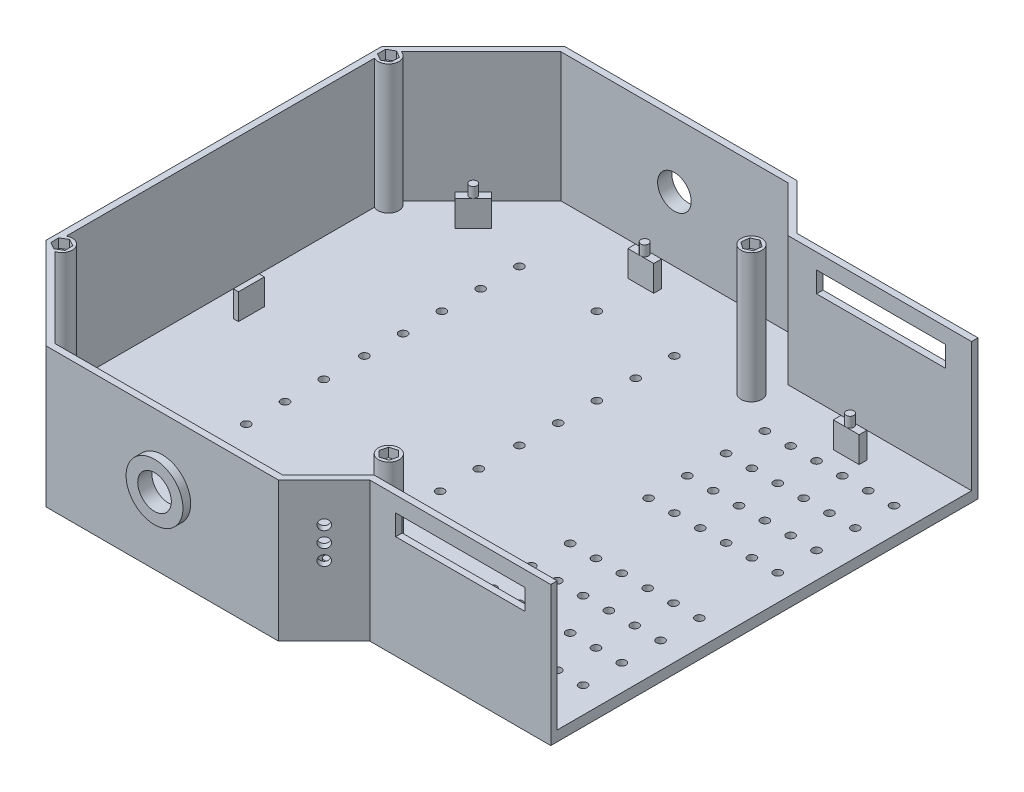
from build123d import *

# Parameters (mm, degrees)
Y_KSEKLIK_EKSTR_ZYON1_DEPTH = 4
Y_KSEKLIK_EKSTR_ZYON2_DEPTH = 50
IZIM7_W                     = 10
IZIM7_H                     = 3
IZIM7_W_2                   = 2
IZIM7_H_2                   = 10
Y_KSEKLIK_EKSTR_ZYON3_DEPTH = 10
IZIM8_R                     = 11
Y_KSEKLIK_EKSTR_ZYON5_DEPTH = 3
Y_KSEKLIK_EKSTR_ZYON6_START = 3
IZIM9_R                     = 11
Y_KSEKLIK_EKSTR_ZYON6_DEPTH = 3
IZIM11_R                    = 6.5
KES_EKSTR_ZYON4_DEPTH       = 232
IZIM12_R                    = 1.6
KES_EKSTR_ZYON5_DEPTH       = 10
IZIM13_R                    = 1.6
KES_EKSTR_ZYON6_DEPTH       = 10
IZIM15_W                    = 50
IZIM15_H                    = 8
KES_EKSTR_ZYON8_DEPTH       = 190
IZIM16_R                    = 4
Y_KSEKLIK_EKSTR_ZYON7_DEPTH = 50
IZIM17_R                    = 1.6
KES_EKSTR_ZYON9_DEPTH       = 190
KES_EKSTR_ZYON10_DEPTH      = 3.5
IZIM19_R                    = 1.5
Y_KSEKLIK_EKSTR_ZYON8_DEPTH = 14
IZIM20_R                    = 2
KES_EKSTR_ZYON11_DEPTH      = 14
IZIM21_R                    = 2
KES_EKSTR_ZYON12_DEPTH      = 14


with BuildPart() as part:
    # Çizim1 → Yükseklik-Ekstrüzyon1 (new body)
    with BuildSketch(Plane(origin=(0, 0, 0), x_dir=(1, 0, 0), z_dir=(0, 1, 0))):
        Polygon((-93.907506655, 105.577086382), (-129.262845715, 70.221747322), (-129.262845715, -59.778252678), (-93.907506655, -95.133591737), (-3.907506655, -95.133591737), (13.770162874, -77.455922207), (83.770162874, -77.455922207), (83.770162874, 87.899416852), (13.770162874, 87.899416852), (-3.907506655, 105.577086382), align=None)
    extrude(amount=Y_KSEKLIK_EKSTR_ZYON1_DEPTH)

    # Çizim2 → Yükseklik-Ekstrüzyon2 (add)
    with BuildSketch(Plane(origin=(0, 4, 0), x_dir=(1, 0, 0), z_dir=(0, 1, 0))):
        Polygon((83.770162874, 87.899416852), (13.770162874, 87.899416852), (-3.907506655, 105.577086382), (-93.907506655, 105.577086382), (-129.262845715, 70.221747322), (-129.262845715, -59.778252678), (-93.907506655, -95.133591737), (-3.907506655, -95.133591737), (13.770162874, -77.455922207), (83.770162874, -77.455922207), (83.770162874, -74.955922207), (12.734628968, -74.955922207), (-4.943040561, -92.633591737), (-92.871972749, -92.633591737), (-126.762845715, -58.742718772), (-126.762845715, 69.186213416), (-92.871972749, 103.077086382), (-4.943040561, 103.077086382), (12.734628968, 85.399416852), (83.770162874, 85.399416852), align=None)
    extrude(amount=Y_KSEKLIK_EKSTR_ZYON2_DEPTH)

    # Çizim7 → Yükseklik-Ekstrüzyon3 (add)
    with BuildSketch(Plane(origin=(0, 4, 0), x_dir=(1, 0, 0), z_dir=(0, 1, 0))):
        with Locations((48.252395921, 73.899416852)):
            Rectangle(IZIM7_W, IZIM7_H)
        Polygon((-6.710807514, 90.702717711), (0.360260298, 83.631649899), (-1.761060046, 81.510329555), (-8.832127858, 88.581397367), align=None)
        with Locations((-48.907506655, 91.577086382)):
            Rectangle(IZIM7_W, IZIM7_H)
        Polygon((-106.281875326, 75.525048181), (-99.210807514, 82.596115993), (-97.089487171, 80.474795649), (-104.160554983, 73.403727838), align=None)
        with Locations((-115.762845715, 5.221747322)):
            Rectangle(IZIM7_W_2, IZIM7_H_2)
        with Locations((48.252395921, -63.455922207)):
            Rectangle(IZIM7_W, IZIM7_H)
        Polygon((0.360260298, -73.188155254), (-1.761060046, -71.066834911), (-8.832127858, -78.137902723), (-6.710807514, -80.259223066), align=None)
        with Locations((-48.907506655, -81.133591737)):
            Rectangle(IZIM7_W, IZIM7_H)
        Polygon((-104.160554983, -62.960233193), (-106.281875326, -65.081553537), (-99.210807514, -72.152621349), (-97.089487171, -70.031301005), align=None)
    extrude(amount=Y_KSEKLIK_EKSTR_ZYON3_DEPTH)

    # Çizim8 → Yükseklik-Ekstrüzyon5 (add)
    with BuildSketch(Plane.XY.offset(95.133591737)):
        with Locations((-48.907506655, 29)):
            Circle(IZIM8_R)
    extrude(amount=Y_KSEKLIK_EKSTR_ZYON5_DEPTH)

    # Çizim9 → Yükseklik-Ekstrüzyon6 (add)
    with BuildSketch(Plane(origin=(0, 0, -105.577086382), x_dir=(-1, 0, 0), z_dir=(0, 0, -1)).offset(Y_KSEKLIK_EKSTR_ZYON6_START)):
        with Locations(Location((48.907506655, 29, 0), (0, 0, 180))):
            Circle(IZIM9_R)
    extrude(amount=-Y_KSEKLIK_EKSTR_ZYON6_DEPTH)

    # Çizim11 → Kes-Ekstrüzyon4 (cut)
    with BuildSketch(Plane(origin=(0, 0, -108.577086382), x_dir=(-1, 0, 0), z_dir=(0, 0, -1))):
        with Locations((48.907506655, 29)):
            Circle(IZIM11_R)
    extrude(amount=-KES_EKSTR_ZYON4_DEPTH, mode=Mode.SUBTRACT)

    # Çizim12 → Kes-Ekstrüzyon5 (cut)
    with BuildSketch(Plane(origin=(0, 4, 0), x_dir=(1, 0, 0), z_dir=(0, 1, 0))):
        with Locations(Location((-78.907506655, 73.077086382, 0), (0, 0, 270))):
            Circle(IZIM12_R)
        with Locations(Location((-18.907506655, 73.077086382, 0), (0, 0, 270))):
            Circle(IZIM12_R)
        with Locations(Location((-18.907506655, 58.077086382, 0), (0, 0, 270))):
            Circle(IZIM12_R)
        with Locations(Location((-18.907506655, 43.077086382, 0), (0, 0, 270))):
            Circle(IZIM12_R)
        with Locations(Location((-18.907506655, 28.077086382, 0), (0, 0, 270))):
            Circle(IZIM12_R)
        with Locations(Location((-18.907506655, 13.077086382, 0), (0, 0, 270))):
            Circle(IZIM12_R)
        with Locations(Location((-18.907506655, -2.633591737, 0), (0, 0, 270))):
            Circle(IZIM12_R)
        with Locations(Location((-18.907506655, -17.633591737, 0), (0, 0, 270))):
            Circle(IZIM12_R)
        with Locations(Location((-18.907506655, -32.633591737, 0), (0, 0, 270))):
            Circle(IZIM12_R)
        with Locations(Location((-18.907506655, -47.633591737, 0), (0, 0, 270))):
            Circle(IZIM12_R)
        with Locations(Location((-78.907506655, -47.633591737, 0), (0, 0, 270))):
            Circle(IZIM12_R)
        with Locations(Location((-78.907506655, -62.633591737, 0), (0, 0, 270))):
            Circle(IZIM12_R)
        with Locations(Location((-18.907506655, -62.633591737, 0), (0, 0, 270))):
            Circle(IZIM12_R)
        with Locations(Location((-78.907506655, 58.077086382, 0), (0, 0, 270))):
            Circle(IZIM12_R)
        with Locations(Location((-78.907506655, 43.077086382, 0), (0, 0, 270))):
            Circle(IZIM12_R)
        with Locations(Location((-78.907506655, 28.077086382, 0), (0, 0, 270))):
            Circle(IZIM12_R)
        with Locations(Location((-78.907506655, 13.077086382, 0), (0, 0, 270))):
            Circle(IZIM12_R)
        with Locations(Location((-78.907506655, -2.633591737, 0), (0, 0, 270))):
            Circle(IZIM12_R)
        with Locations(Location((-78.907506655, -17.633591737, 0), (0, 0, 270))):
            Circle(IZIM12_R)
        with Locations(Location((-78.907506655, -32.633591737, 0), (0, 0, 270))):
            Circle(IZIM12_R)
        with Locations(Location((-48.907506655, -62.633591737, 0), (0, 0, 270))):
            Circle(IZIM12_R)
        with Locations(Location((-48.907506655, 73.077086382, 0), (0, 0, 270))):
            Circle(IZIM12_R)
    extrude(amount=-KES_EKSTR_ZYON5_DEPTH, mode=Mode.SUBTRACT)

    # Çizim13 → Kes-Ekstrüzyon6 (cut)
    with BuildSketch(Plane(origin=(0, 4, 0), x_dir=(1, 0, 0), z_dir=(0, 1, 0))):
        with Locations(Location((73.770162874, 65.399416852, 0), (0, 0, 270))):
            Circle(IZIM13_R)
        with Locations(Location((63.770162874, 65.399416852, 0), (0, 0, 270))):
            Circle(IZIM13_R)
        with Locations(Location((53.770162874, 65.399416852, 0), (0, 0, 270))):
            Circle(IZIM13_R)
        with Locations(Location((43.770162874, 65.399416852, 0), (0, 0, 270))):
            Circle(IZIM13_R)
        with Locations(Location((33.770162874, 65.399416852, 0), (0, 0, 270))):
            Circle(IZIM13_R)
        with Locations(Location((23.770162874, 65.399416852, 0), (0, 0, 270))):
            Circle(IZIM13_R)
        with Locations(Location((23.770162874, 50.399416852, 0), (0, 0, 270))):
            Circle(IZIM13_R)
        with Locations(Location((33.770162874, 50.399416852, 0), (0, 0, 270))):
            Circle(IZIM13_R)
        with Locations(Location((43.770162874, 50.399416852, 0), (0, 0, 270))):
            Circle(IZIM13_R)
        with Locations(Location((53.770162874, 50.399416852, 0), (0, 0, 270))):
            Circle(IZIM13_R)
        with Locations(Location((63.770162874, 50.399416852, 0), (0, 0, 270))):
            Circle(IZIM13_R)
        with Locations(Location((73.770162874, 50.399416852, 0), (0, 0, 270))):
            Circle(IZIM13_R)
        with Locations(Location((53.770162874, 35.399416852, 0), (0, 0, 90))):
            Circle(IZIM13_R)
        with Locations(Location((63.770162874, 35.399416852, 0), (0, 0, 90))):
            Circle(IZIM13_R)
        with Locations(Location((73.770162874, 35.399416852, 0), (0, 0, 90))):
            Circle(IZIM13_R)
        with Locations(Location((73.770162874, 20.399416852, 0), (0, 0, 90))):
            Circle(IZIM13_R)
        with Locations(Location((63.770162874, 20.399416852, 0), (0, 0, 90))):
            Circle(IZIM13_R)
        with Locations(Location((53.770162874, 20.399416852, 0), (0, 0, 90))):
            Circle(IZIM13_R)
        with Locations(Location((43.770162874, 20.399416852, 0), (0, 0, 90))):
            Circle(IZIM13_R)
        with Locations(Location((43.770162874, 35.399416852, 0), (0, 0, 90))):
            Circle(IZIM13_R)
        with Locations(Location((33.770162874, 35.399416852, 0), (0, 0, 90))):
            Circle(IZIM13_R)
        with Locations(Location((33.770162874, 20.399416852, 0), (0, 0, 90))):
            Circle(IZIM13_R)
        with Locations(Location((23.770162874, 20.399416852, 0), (0, 0, 90))):
            Circle(IZIM13_R)
        with Locations(Location((23.770162874, 35.399416852, 0), (0, 0, 90))):
            Circle(IZIM13_R)
        with Locations(Location((23.770162874, -24.955922207, 0), (0, 0, 270))):
            Circle(IZIM13_R)
        with Locations(Location((23.770162874, -9.955922207, 0), (0, 0, 270))):
            Circle(IZIM13_R)
        with Locations(Location((33.770162874, -9.955922207, 0), (0, 0, 270))):
            Circle(IZIM13_R)
        with Locations(Location((33.770162874, -24.955922207, 0), (0, 0, 270))):
            Circle(IZIM13_R)
        with Locations(Location((43.770162874, -24.955922207, 0), (0, 0, 270))):
            Circle(IZIM13_R)
        with Locations(Location((43.770162874, -9.955922207, 0), (0, 0, 270))):
            Circle(IZIM13_R)
        with Locations(Location((53.770162874, -9.955922207, 0), (0, 0, 270))):
            Circle(IZIM13_R)
        with Locations(Location((63.770162874, -9.955922207, 0), (0, 0, 270))):
            Circle(IZIM13_R)
        with Locations(Location((73.770162874, -9.955922207, 0), (0, 0, 270))):
            Circle(IZIM13_R)
        with Locations(Location((73.770162874, -24.955922207, 0), (0, 0, 270))):
            Circle(IZIM13_R)
        with Locations(Location((63.770162874, -24.955922207, 0), (0, 0, 270))):
            Circle(IZIM13_R)
        with Locations(Location((53.770162874, -24.955922207, 0), (0, 0, 270))):
            Circle(IZIM13_R)
        with Locations(Location((73.770162874, -39.955922207, 0), (0, 0, 90))):
            Circle(IZIM13_R)
        with Locations(Location((63.770162874, -39.955922207, 0), (0, 0, 90))):
            Circle(IZIM13_R)
        with Locations(Location((53.770162874, -39.955922207, 0), (0, 0, 90))):
            Circle(IZIM13_R)
        with Locations(Location((43.770162874, -39.955922207, 0), (0, 0, 90))):
            Circle(IZIM13_R)
        with Locations(Location((33.770162874, -39.955922207, 0), (0, 0, 90))):
            Circle(IZIM13_R)
        with Locations(Location((23.770162874, -39.955922207, 0), (0, 0, 90))):
            Circle(IZIM13_R)
        with Locations(Location((23.770162874, -54.955922207, 0), (0, 0, 90))):
            Circle(IZIM13_R)
        with Locations(Location((33.770162874, -54.955922207, 0), (0, 0, 90))):
            Circle(IZIM13_R)
        with Locations(Location((43.770162874, -54.955922207, 0), (0, 0, 90))):
            Circle(IZIM13_R)
        with Locations(Location((53.770162874, -54.955922207, 0), (0, 0, 90))):
            Circle(IZIM13_R)
        with Locations(Location((63.770162874, -54.955922207, 0), (0, 0, 90))):
            Circle(IZIM13_R)
        with Locations(Location((73.770162874, -54.955922207, 0), (0, 0, 90))):
            Circle(IZIM13_R)
    extrude(amount=-KES_EKSTR_ZYON6_DEPTH, mode=Mode.SUBTRACT)

    # Çizim15 → Kes-Ekstrüzyon8 (cut)
    with BuildSketch(Plane.XY.offset(77.455922207)):
        with Locations((48.770162874, 44)):
            Rectangle(IZIM15_W, IZIM15_H)
    extrude(amount=-KES_EKSTR_ZYON8_DEPTH, mode=Mode.SUBTRACT)

    # Çizim16 → Yükseklik-Ekstrüzyon7 (add)
    with BuildSketch(Plane(origin=(0, 4, 0), x_dir=(1, 0, 0), z_dir=(0, 1, 0))):
        with Locations(Location((8.592493345, 75.399416852, 0), (0, 0, 90))):
            Circle(IZIM16_R)
        with Locations((-124.91508665, 68.420846552)):
            Circle(IZIM16_R)
        with Locations((-124.91508665, -57.977351907)):
            Circle(IZIM16_R)
        with Locations(Location((8.592493345, -64.955922207, 0), (0, 0, 90))):
            Circle(IZIM16_R)
    extrude(amount=Y_KSEKLIK_EKSTR_ZYON7_DEPTH)

    # Çizim17 → Kes-Ekstrüzyon9 (cut)
    with BuildSketch(Plane(origin=(0, 54, 0), x_dir=(1, 0, 0), z_dir=(0, 1, 0))):
        with Locations(Location((-124.91508665, 68.420846552, 0), (0, 0, 270))):
            Circle(IZIM17_R)
        with Locations(Location((-124.91508665, -57.977351907, 0), (0, 0, 270))):
            Circle(IZIM17_R)
        with Locations(Location((8.592493345, 75.399416852, 0), (0, 0, 270))):
            Circle(IZIM17_R)
        with Locations(Location((8.592493345, -64.955922207, 0), (0, 0, 270))):
            Circle(IZIM17_R)
    extrude(amount=-KES_EKSTR_ZYON9_DEPTH, mode=Mode.SUBTRACT)

    # Çizim18 → Kes-Ekstrüzyon10 (cut)
    with BuildSketch(Plane(origin=(0, 54, 0), x_dir=(1, 0, 0), z_dir=(0, 1, 0))):
        Polygon((-122.239727613, 66.854815255), (-122.221184245, 69.954759794), (-124.896543282, 71.52079109), (-127.590445687, 69.986877848), (-127.608989054, 66.88693331), (-124.933630017, 65.320902013), align=None)
        Polygon((-122.198371365, -59.470488895), (-122.263634445, -56.37117595), (-124.980349729, -54.878038962), (-127.631801934, -56.48421492), (-127.566538854, -59.583527865), (-124.84982357, -61.076664852), align=None)
        Polygon((10.820187794, -67.111699895), (11.573298812, -64.104571066), (9.345604363, -61.948793378), (6.364798895, -62.800144519), (5.611687877, -65.807273349), (7.839382327, -67.963051036), align=None)
        Polygon((11.110359734, 73.591006267), (11.417556047, 76.675747816), (8.899689657, 78.484158401), (6.074626955, 77.207827437), (5.767430643, 74.123085888), (8.285297032, 72.314675303), align=None)
    extrude(amount=-KES_EKSTR_ZYON10_DEPTH, mode=Mode.SUBTRACT)

    # Çizim19 → Yükseklik-Ekstrüzyon8 (add)
    with BuildSketch(Plane(origin=(0, 4, 0), x_dir=(1, 0, 0), z_dir=(0, 1, 0))):
        with Locations(Location((-101.685681248, 77.999921915, 0), (0, 0, 135))):
            Circle(IZIM19_R)
        with Locations(Location((-101.685681248, -67.556427271, 0), (0, 0, 45))):
            Circle(IZIM19_R)
        with Locations(Location((-48.907506655, -81.133591737, 0), (0, 0, 270))):
            Circle(IZIM19_R)
        with Locations(Location((-4.23593378, -75.663028989, 0), (0, 0, 135))):
            Circle(IZIM19_R)
        with Locations(Location((48.252395921, -63.455922207, 0), (0, 0, 270))):
            Circle(IZIM19_R)
        with Locations(Location((-48.907506655, 91.577086382, 0), (0, 0, 270))):
            Circle(IZIM19_R)
        with Locations(Location((-4.23593378, 86.106523633, 0), (0, 0, 45))):
            Circle(IZIM19_R)
        with Locations(Location((48.252395921, 73.899416852, 0), (0, 0, 270))):
            Circle(IZIM19_R)
    extrude(amount=Y_KSEKLIK_EKSTR_ZYON8_DEPTH)

    # Çizim20 → Kes-Ekstrüzyon11 (cut)
    with BuildSketch(Plane(origin=(45.613042541, 0, 45.613042541), x_dir=(0.7071067811865477, 0, -0.7071067811865474), z_dir=(0.7071067811865474, 0, 0.7071067811865477))):
        with Locations((-57.532632289, 39)):
            Circle(IZIM20_R)
        with Locations((-57.532632289, 33)):
            Circle(IZIM20_R)
        with Locations((-57.532632289, 27)):
            Circle(IZIM20_R)
    extrude(amount=-KES_EKSTR_ZYON11_DEPTH, mode=Mode.SUBTRACT)

    # Çizim21 → Kes-Ekstrüzyon12 (cut)
    with BuildSketch(Plane(origin=(50.834789863, 0, -50.834789863), x_dir=(-0.7071067811865474, 0, -0.7071067811865477), z_dir=(0.7071067811865477, 0, -0.7071067811865474))):
        with Locations((64.917298172, 39)):
            Circle(IZIM21_R)
        with Locations((64.917298172, 33)):
            Circle(IZIM21_R)
        with Locations((64.917298172, 27)):
            Circle(IZIM21_R)
    extrude(amount=-KES_EKSTR_ZYON12_DEPTH, mode=Mode.SUBTRACT)


solid = part.part
